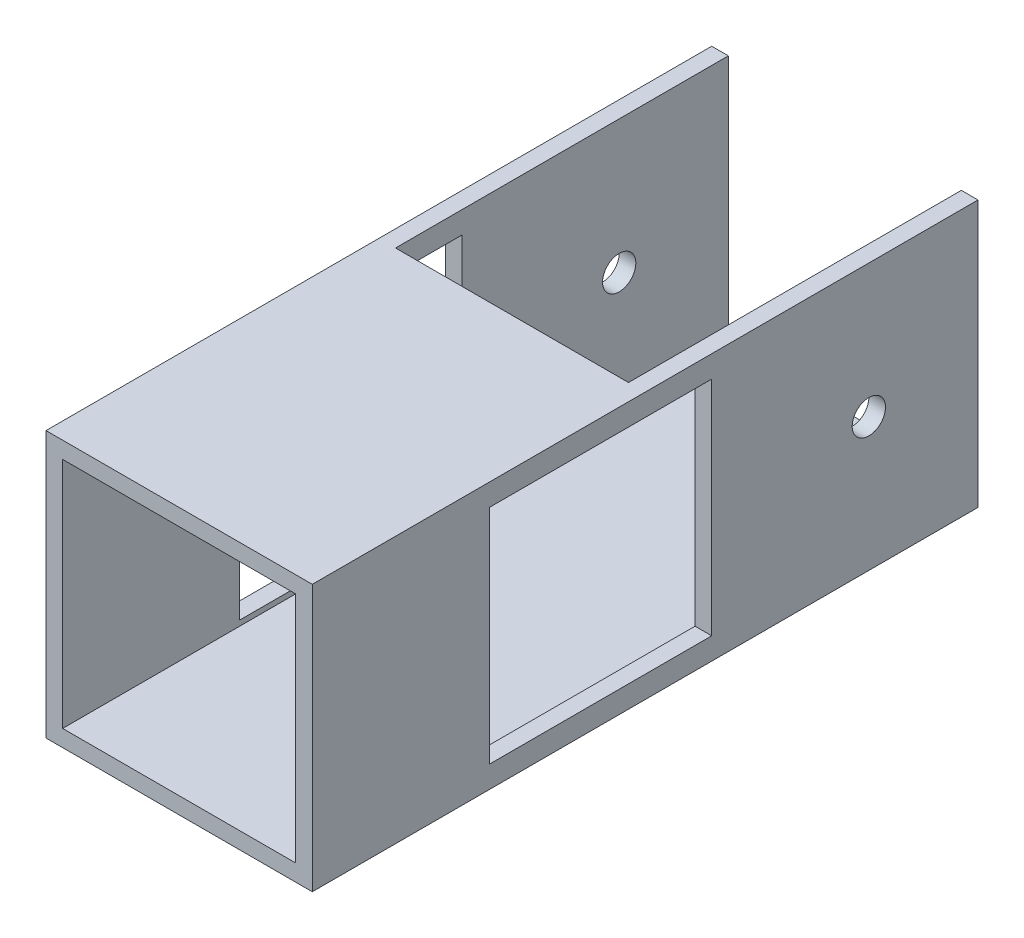
from build123d import *

# Parameters (mm, degrees)
SKETCH2_W           = 50.8
SKETCH2_H           = 50.8
SKETCH2_W_2         = 44.45
SKETCH2_H_2         = 44.45
BOSS_EXTRUDE1_DEPTH = 127
SKETCH4_W           = 44.45
SKETCH4_H           = 63.5
CUT_EXTRUDE1_DEPTH  = 23.368
SKETCH5_R           = 3.175
SKETCH5_W           = 42.418
SKETCH5_H           = 42.418
CUT_EXTRUDE2_DEPTH  = 100.130759523


with BuildPart() as part:
    # Sketch2 → Boss-Extrude1 (new body)
    with BuildSketch(Plane.XY):
        Rectangle(SKETCH2_W, SKETCH2_H)
        Rectangle(SKETCH2_W_2, SKETCH2_H_2, mode=Mode.SUBTRACT)
    extrude(amount=BOSS_EXTRUDE1_DEPTH)

    # Sketch4 → Cut-Extrude1 (cut)
    with BuildSketch(Plane(origin=(0, 25.4, 0), x_dir=(1, 0, 0), z_dir=(0, 1, 0))):
        with Locations((0, -31.75)):
            Rectangle(SKETCH4_W, SKETCH4_H)
    extrude(amount=-CUT_EXTRUDE1_DEPTH, mode=Mode.SUBTRACT)

    # Sketch5 → Cut-Extrude2 (cut)
    with BuildSketch(Plane.ZY.offset(25.4)):
        with Locations(Location((20.828, 0, 0), (0, 0, 270))):
            Circle(SKETCH5_R)
        with Locations((72.009, 0)):
            Rectangle(SKETCH5_W, SKETCH5_H)
    extrude(amount=-CUT_EXTRUDE2_DEPTH, mode=Mode.SUBTRACT)


solid = part.part
